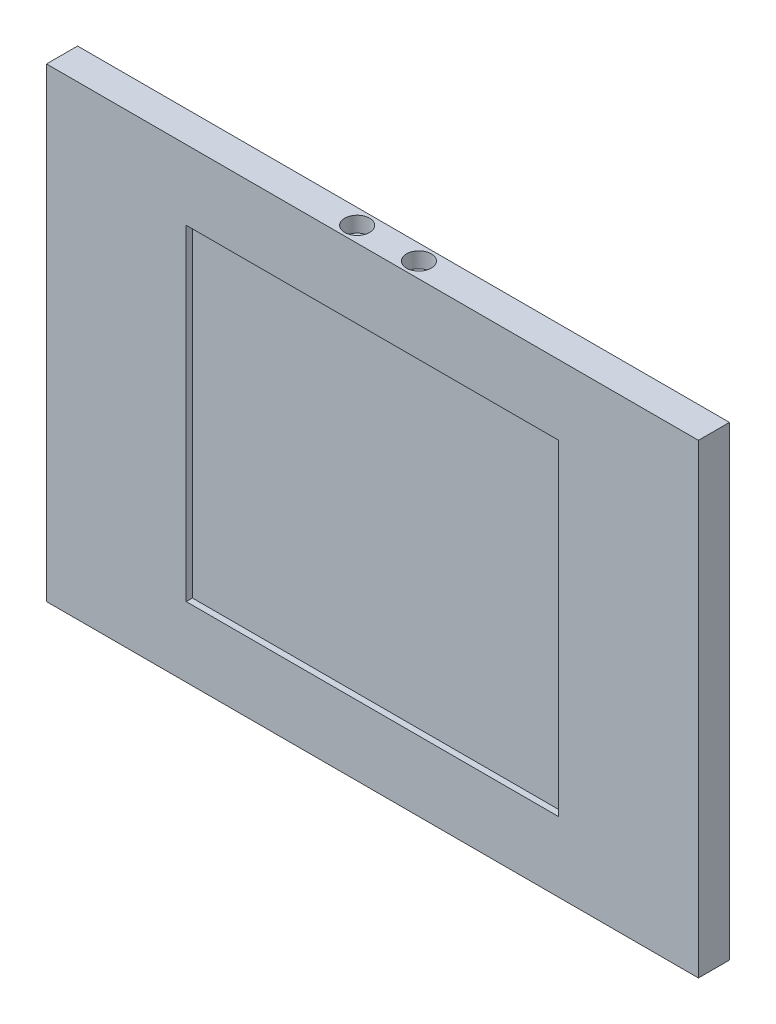
from build123d import *

# Parameters (mm, degrees)
SKETCH1_W           = 210
SKETCH1_H           = 150
BOSS_EXTRUDE1_DEPTH = 10
SKETCH2_W           = 120
SKETCH2_H           = 105
CUT_EXTRUDE1_DEPTH  = 2
SKETCH3_R           = 4
CUT_EXTRUDE2_DEPTH  = 5


with BuildPart() as part:
    # Sketch1 → Boss-Extrude1 (new body)
    with BuildSketch(Plane.XY):
        Rectangle(SKETCH1_W, SKETCH1_H)
    extrude(amount=BOSS_EXTRUDE1_DEPTH)

    # Sketch2 → Cut-Extrude1 (cut)
    with BuildSketch(Plane.XY.offset(10)):
        Rectangle(SKETCH2_W, SKETCH2_H)
    extrude(amount=-CUT_EXTRUDE1_DEPTH, mode=Mode.SUBTRACT)

    # Sketch3 → Cut-Extrude2 (cut)
    with BuildSketch(Plane(origin=(0, 75, 0), x_dir=(1, 0, 0), z_dir=(0, 1, 0))):
        with Locations(Location((-9.942757001, -5, 0), (0, 0, 270))):
            Circle(SKETCH3_R)
        with Locations(Location((9.942757001, -5, 0), (0, 0, 90))):
            Circle(SKETCH3_R)
    extrude(amount=-CUT_EXTRUDE2_DEPTH, mode=Mode.SUBTRACT)


solid = part.part
